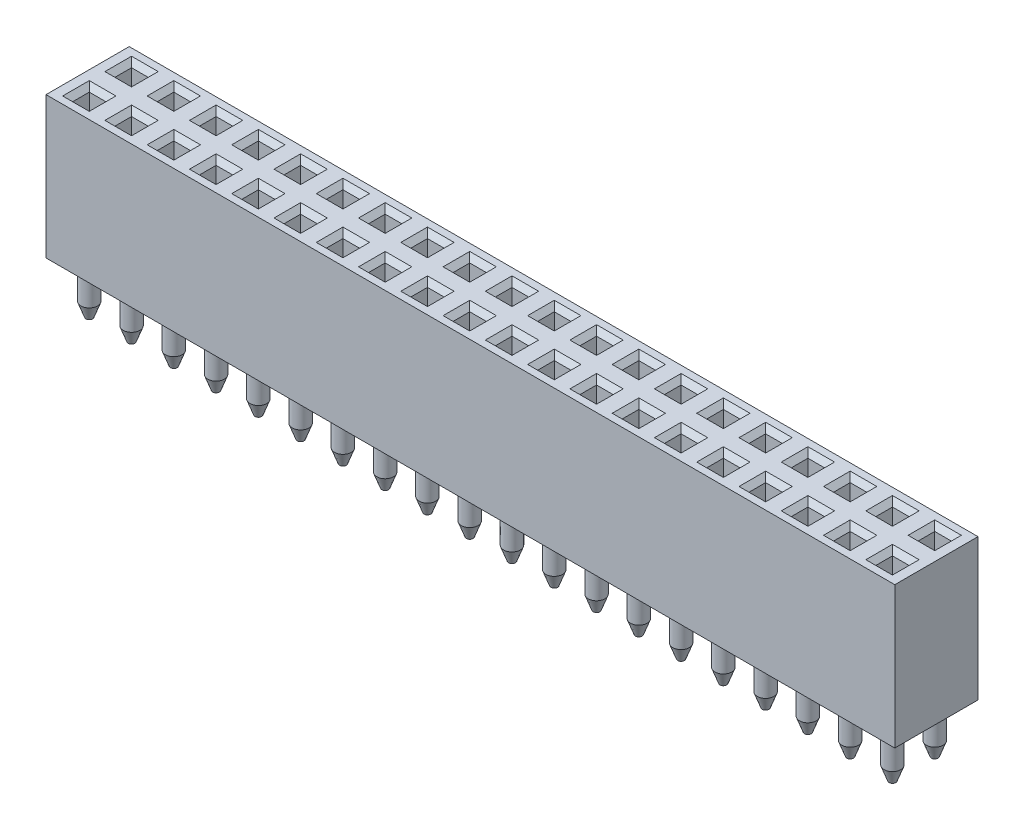
from build123d import *

# Parameters (mm, degrees)
SKETCH3_W                   = 51
SKETCH3_H                   = 5
BOSS_EXTRUDE2_DEPTH         = 8.5
SKETCH4_R                   = 0.5
BOSS_EXTRUDE3_DEPTH         = 3
CHAMFER1_SIZE               = 0.3
CHAMFER1_SIZE2              = 0.824243226
LPATTERN3_COUNT             = 20
LPATTERN3_PITCH             = 2.54
LPATTERN3_COUNT_DIR2        = 2
LPATTERN3_PITCH_DIR2        = 2.54
CHAMFER1_OF_LPATTERN3_SIZE2 = 0.3
CHAMFER1_OF_LPATTERN3_SIZE  = 0.824243226
SKETCH5_W                   = 1
SKETCH5_H                   = 1
CUT_EXTRUDE1_DEPTH          = 7
CHAMFER2_SIZE               = 0.3
LPATTERN6_COUNT             = 20
LPATTERN6_PITCH             = 2.54
LPATTERN6_COUNT_DIR2        = 2
LPATTERN6_PITCH_DIR2        = 2.54
CHAMFER2_OF_LPATTERN6_SIZE  = 0.3


with BuildPart() as part:
    # Sketch3 → Boss-Extrude2 (new body)
    with BuildSketch(Plane(origin=(0, 0, 0), x_dir=(1, 0, 0), z_dir=(0, 1, 0))):
        Rectangle(SKETCH3_W, SKETCH3_H)
    extrude(amount=BOSS_EXTRUDE2_DEPTH)

    # Sketch4 → Boss-Extrude3 (add)
    with BuildSketch(Plane.XZ):
        with Locations(Location((-24.13, -1.27, 0), (0, 0, 270))):
            Circle(SKETCH4_R)
    boss_extrude3 = extrude(amount=BOSS_EXTRUDE3_DEPTH)

    # Chamfer1
    chamfer1_edges = [part.edges().sort_by_distance(p)[0] for p in [
        (-24.13, -3, -0.77),
    ]]
    chamfer1_side = [part.faces().sort_by_distance(p)[0] for p in [
        (-24.13, -3, -1.27),
    ]]
    chamfer(chamfer1_edges, length=CHAMFER1_SIZE, length2=CHAMFER1_SIZE2, reference=chamfer1_side[0])

    # LPattern3: Boss-Extrude3 20 × 2
    with Locations(*[(i * LPATTERN3_PITCH, 0, j * LPATTERN3_PITCH_DIR2) for i in range(LPATTERN3_COUNT) for j in range(LPATTERN3_COUNT_DIR2) if (i, j) != (0, 0)]):
        add(boss_extrude3)

    # Chamfer1 of LPattern3
    chamfer1_of_lpattern3_edges = [part.edges().sort_by_distance(p)[0] for p in [
        (-24.13, -3, 1.77),
        (-21.59, -3, -0.77),
        (-21.59, -3, 1.77),
        (-19.05, -3, -0.77),
        (-19.05, -3, 1.77),
        (-16.51, -3, -0.77),
        (-16.51, -3, 1.77),
        (-13.97, -3, -0.77),
        (-13.97, -3, 1.77),
        (-11.43, -3, -0.77),
        (-11.43, -3, 1.77),
        (-8.89, -3, -0.77),
        (-8.89, -3, 1.77),
        (-6.35, -3, -0.77),
        (-6.35, -3, 1.77),
        (-3.81, -3, -0.77),
        (-3.81, -3, 1.77),
        (-1.27, -3, -0.77),
        (-1.27, -3, 1.77),
        (1.27, -3, -0.77),
        (1.27, -3, 1.77),
        (3.81, -3, -0.77),
        (3.81, -3, 1.77),
        (6.35, -3, -0.77),
        (6.35, -3, 1.77),
        (8.89, -3, -0.77),
        (8.89, -3, 1.77),
        (11.43, -3, -0.77),
        (11.43, -3, 1.77),
        (13.97, -3, -0.77),
        (13.97, -3, 1.77),
        (16.51, -3, -0.77),
        (16.51, -3, 1.77),
        (19.05, -3, -0.77),
        (19.05, -3, 1.77),
        (21.59, -3, -0.77),
        (21.59, -3, 1.77),
        (24.13, -3, -0.77),
        (24.13, -3, 1.77),
    ]]
    chamfer(chamfer1_of_lpattern3_edges, length=CHAMFER1_OF_LPATTERN3_SIZE, length2=CHAMFER1_OF_LPATTERN3_SIZE2)

    # Sketch5 → Cut-Extrude1 (cut)
    with BuildSketch(Plane(origin=(0, 8.5, 0), x_dir=(1, 0, 0), z_dir=(0, 1, 0))):
        with Locations((-24.13, -1.27)):
            Rectangle(SKETCH5_W, SKETCH5_H)
    cut_extrude1 = extrude(amount=-CUT_EXTRUDE1_DEPTH, mode=Mode.SUBTRACT)

    # Chamfer2
    chamfer2_edges = [part.edges().sort_by_distance(p)[0] for p in [
        (-23.63, 8.5, 1.27),
        (-24.13, 8.5, 0.77),
        (-24.63, 8.5, 1.27),
        (-24.13, 8.5, 1.77),
    ]]
    chamfer(chamfer2_edges, length=CHAMFER2_SIZE)

    # LPattern6: Cut-Extrude1 20 × 2
    with Locations(*[(i * LPATTERN6_PITCH, 0, -j * LPATTERN6_PITCH_DIR2) for i in range(LPATTERN6_COUNT) for j in range(LPATTERN6_COUNT_DIR2) if (i, j) != (0, 0)]):
        add(cut_extrude1, mode=Mode.SUBTRACT)

    # Chamfer2 of LPattern6
    chamfer2_of_lpattern6_edges = [part.edges().sort_by_distance(p)[0] for p in [
        (-23.63, 8.5, -1.27),
        (-24.13, 8.5, -1.77),
        (-24.63, 8.5, -1.27),
        (-24.13, 8.5, -0.77),
        (-21.09, 8.5, 1.27),
        (-21.59, 8.5, 0.77),
        (-22.09, 8.5, 1.27),
        (-21.59, 8.5, 1.77),
        (-21.09, 8.5, -1.27),
        (-21.59, 8.5, -1.77),
        (-22.09, 8.5, -1.27),
        (-21.59, 8.5, -0.77),
        (-18.55, 8.5, 1.27),
        (-19.05, 8.5, 0.77),
        (-19.55, 8.5, 1.27),
        (-19.05, 8.5, 1.77),
        (-18.55, 8.5, -1.27),
        (-19.05, 8.5, -1.77),
        (-19.55, 8.5, -1.27),
        (-19.05, 8.5, -0.77),
        (-16.01, 8.5, 1.27),
        (-16.51, 8.5, 0.77),
        (-17.01, 8.5, 1.27),
        (-16.51, 8.5, 1.77),
        (-16.01, 8.5, -1.27),
        (-16.51, 8.5, -1.77),
        (-17.01, 8.5, -1.27),
        (-16.51, 8.5, -0.77),
        (-13.47, 8.5, 1.27),
        (-13.97, 8.5, 0.77),
        (-14.47, 8.5, 1.27),
        (-13.97, 8.5, 1.77),
        (-13.47, 8.5, -1.27),
        (-13.97, 8.5, -1.77),
        (-14.47, 8.5, -1.27),
        (-13.97, 8.5, -0.77),
        (-10.93, 8.5, 1.27),
        (-11.43, 8.5, 0.77),
        (-11.93, 8.5, 1.27),
        (-11.43, 8.5, 1.77),
        (-10.93, 8.5, -1.27),
        (-11.43, 8.5, -1.77),
        (-11.93, 8.5, -1.27),
        (-11.43, 8.5, -0.77),
        (-8.39, 8.5, 1.27),
        (-8.89, 8.5, 0.77),
        (-9.39, 8.5, 1.27),
        (-8.89, 8.5, 1.77),
        (-8.39, 8.5, -1.27),
        (-8.89, 8.5, -1.77),
        (-9.39, 8.5, -1.27),
        (-8.89, 8.5, -0.77),
        (-5.85, 8.5, 1.27),
        (-6.35, 8.5, 0.77),
        (-6.85, 8.5, 1.27),
        (-6.35, 8.5, 1.77),
        (-5.85, 8.5, -1.27),
        (-6.35, 8.5, -1.77),
        (-6.85, 8.5, -1.27),
        (-6.35, 8.5, -0.77),
        (-3.31, 8.5, 1.27),
        (-3.81, 8.5, 0.77),
        (-4.31, 8.5, 1.27),
        (-3.81, 8.5, 1.77),
        (-3.31, 8.5, -1.27),
        (-3.81, 8.5, -1.77),
        (-4.31, 8.5, -1.27),
        (-3.81, 8.5, -0.77),
        (-0.77, 8.5, 1.27),
        (-1.27, 8.5, 0.77),
        (-1.77, 8.5, 1.27),
        (-1.27, 8.5, 1.77),
        (-0.77, 8.5, -1.27),
        (-1.27, 8.5, -1.77),
        (-1.77, 8.5, -1.27),
        (-1.27, 8.5, -0.77),
        (1.77, 8.5, 1.27),
        (1.27, 8.5, 0.77),
        (0.77, 8.5, 1.27),
        (1.27, 8.5, 1.77),
        (1.77, 8.5, -1.27),
        (1.27, 8.5, -1.77),
        (0.77, 8.5, -1.27),
        (1.27, 8.5, -0.77),
        (4.31, 8.5, 1.27),
        (3.81, 8.5, 0.77),
        (3.31, 8.5, 1.27),
        (3.81, 8.5, 1.77),
        (4.31, 8.5, -1.27),
        (3.81, 8.5, -1.77),
        (3.31, 8.5, -1.27),
        (3.81, 8.5, -0.77),
        (6.85, 8.5, 1.27),
        (6.35, 8.5, 0.77),
        (5.85, 8.5, 1.27),
        (6.35, 8.5, 1.77),
        (6.85, 8.5, -1.27),
        (6.35, 8.5, -1.77),
        (5.85, 8.5, -1.27),
        (6.35, 8.5, -0.77),
        (9.39, 8.5, 1.27),
        (8.89, 8.5, 0.77),
        (8.39, 8.5, 1.27),
        (8.89, 8.5, 1.77),
        (9.39, 8.5, -1.27),
        (8.89, 8.5, -1.77),
        (8.39, 8.5, -1.27),
        (8.89, 8.5, -0.77),
        (11.93, 8.5, 1.27),
        (11.43, 8.5, 0.77),
        (10.93, 8.5, 1.27),
        (11.43, 8.5, 1.77),
        (11.93, 8.5, -1.27),
        (11.43, 8.5, -1.77),
        (10.93, 8.5, -1.27),
        (11.43, 8.5, -0.77),
        (14.47, 8.5, 1.27),
        (13.97, 8.5, 0.77),
        (13.47, 8.5, 1.27),
        (13.97, 8.5, 1.77),
        (14.47, 8.5, -1.27),
        (13.97, 8.5, -1.77),
        (13.47, 8.5, -1.27),
        (13.97, 8.5, -0.77),
        (17.01, 8.5, 1.27),
        (16.51, 8.5, 0.77),
        (16.01, 8.5, 1.27),
        (16.51, 8.5, 1.77),
        (17.01, 8.5, -1.27),
        (16.51, 8.5, -1.77),
        (16.01, 8.5, -1.27),
        (16.51, 8.5, -0.77),
        (19.55, 8.5, 1.27),
        (19.05, 8.5, 0.77),
        (18.55, 8.5, 1.27),
        (19.05, 8.5, 1.77),
        (19.55, 8.5, -1.27),
        (19.05, 8.5, -1.77),
        (18.55, 8.5, -1.27),
        (19.05, 8.5, -0.77),
        (22.09, 8.5, 1.27),
        (21.59, 8.5, 0.77),
        (21.09, 8.5, 1.27),
        (21.59, 8.5, 1.77),
        (22.09, 8.5, -1.27),
        (21.59, 8.5, -1.77),
        (21.09, 8.5, -1.27),
        (21.59, 8.5, -0.77),
        (24.63, 8.5, 1.27),
        (24.13, 8.5, 0.77),
        (23.63, 8.5, 1.27),
        (24.13, 8.5, 1.77),
        (24.63, 8.5, -1.27),
        (24.13, 8.5, -1.77),
        (23.63, 8.5, -1.27),
        (24.13, 8.5, -0.77),
    ]]
    chamfer(chamfer2_of_lpattern6_edges, length=CHAMFER2_OF_LPATTERN6_SIZE)


solid = part.part
